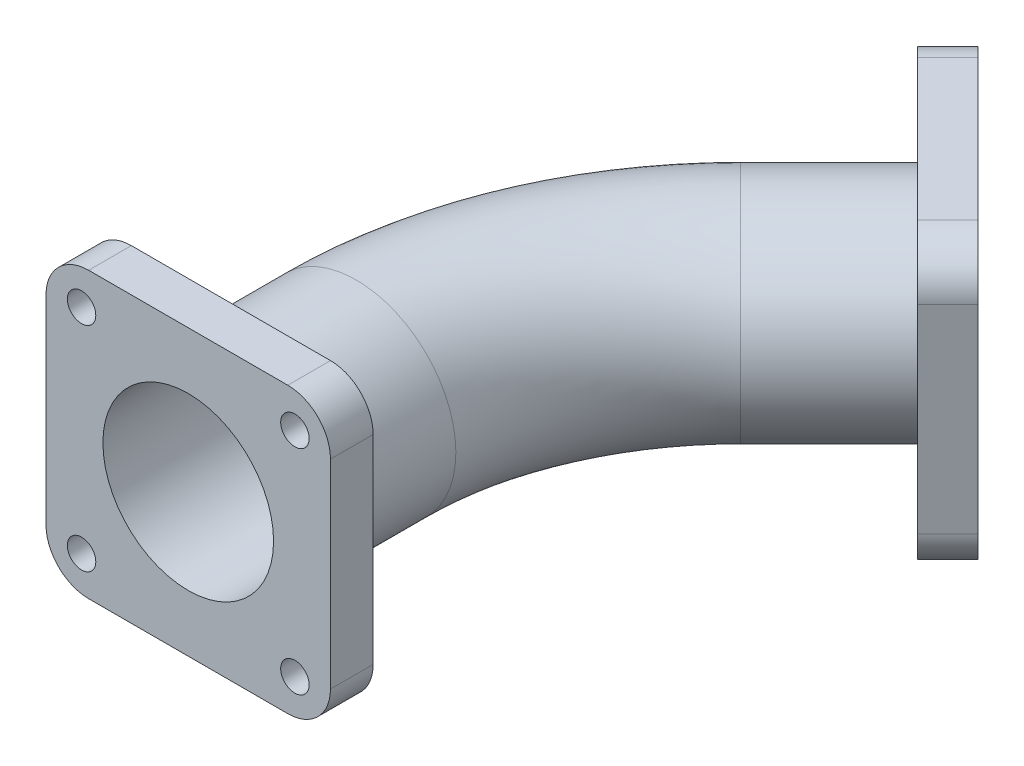
from build123d import *

# Parameters (mm, degrees)
CROQUIS1_W              = 100
CROQUIS1_H              = 100
SALIENTE_EXTRUIR1_DEPTH = 15
CROQUIS2_R              = 30
CROQUIS2_R_2            = 5
CORTAR_EXTRUIR1_DEPTH   = 15
CROQUIS9_R              = 35
CROQUIS9_R_2            = 30
CROQUIS12_W             = 100
CROQUIS12_H             = 100
SALIENTE_EXTRUIR2_DEPTH = 15
CORTAR_EXTRUIR2_START   = 15
CROQUIS13_R             = 30
CROQUIS13_R_2           = 5
CORTAR_EXTRUIR2_DEPTH   = 15
REDONDEO1_R             = 15


with BuildPart() as part:
    # Croquis1 → Saliente-Extruir1 (new body)
    with BuildSketch(Plane.XY):
        Rectangle(CROQUIS1_W, CROQUIS1_H)
    extrude(amount=SALIENTE_EXTRUIR1_DEPTH)

    # Croquis2 → Cortar-Extruir1 (cut)
    with BuildSketch(Plane.XY):
        Circle(CROQUIS2_R)
        with Locations((-37.5, 37.5)):
            Circle(CROQUIS2_R_2)
        with Locations((37.5, 37.5)):
            Circle(CROQUIS2_R_2)
        with Locations((37.5, -37.5)):
            Circle(CROQUIS2_R_2)
        with Locations((-37.5, -37.5)):
            Circle(CROQUIS2_R_2)
    extrude(amount=CORTAR_EXTRUIR1_DEPTH, mode=Mode.SUBTRACT)

    # Barrer1: sweep along a path in Croquis3
    with BuildLine(Plane(origin=(0, 0, 0), x_dir=(1, 0, 0), z_dir=(0, 1, 0))) as barrer1_path:
        Line((0, 0), (0, 44.08116908))
        ThreePointArc((0, 44.08116908), (10.276263111, 95.743432449), (39.54058454, 139.54058454))
        Line((39.54058454, 139.54058454), (70.710678119, 170.710678119))
    # Croquis9 → Barrer1 (sweep)
    with BuildSketch(Plane.XY):
        Circle(CROQUIS9_R)
        Circle(CROQUIS9_R_2, mode=Mode.SUBTRACT)
    sweep(path=barrer1_path.line)

    # Croquis12 → Saliente-Extruir2 (add)
    with BuildSketch(Plane(origin=(120.710678119, 0, -120.710678119), x_dir=(-0.7071067811865462, 0, -0.7071067811865489), z_dir=(0.7071067811865489, 0, -0.7071067811865462))):
        with Locations((70.710678119, 0)):
            Rectangle(CROQUIS12_W, CROQUIS12_H)
    extrude(amount=SALIENTE_EXTRUIR2_DEPTH)

    # Croquis13 → Cortar-Extruir2 (cut)
    with BuildSketch(Plane(origin=(120.710678119, 0, -120.710678119), x_dir=(-0.7071067811865462, 0, -0.7071067811865489), z_dir=(0.7071067811865489, 0, -0.7071067811865462)).offset(CORTAR_EXTRUIR2_START)):
        with Locations((70.710678119, 0)):
            Circle(CROQUIS13_R)
        with Locations((108.210678119, 37.5)):
            Circle(CROQUIS13_R_2)
        with Locations((108.210678119, -37.5)):
            Circle(CROQUIS13_R_2)
        with Locations((33.210678119, -37.5)):
            Circle(CROQUIS13_R_2)
        with Locations((33.210678119, 37.5)):
            Circle(CROQUIS13_R_2)
    extrude(amount=-CORTAR_EXTRUIR2_DEPTH, mode=Mode.SUBTRACT)

    # Redondeo1
    redondeo1_edges = [part.edges().sort_by_distance(p)[0] for p in [
        (40.658639918, -50, -211.369318037),
        (40.658639918, 50, -211.369318037),
        (111.369318037, 50, -140.658639918),
        (111.369318037, -50, -140.658639918),
        (50, -50, 7.5),
        (-50, -50, 7.5),
        (-50, 50, 7.5),
        (50, 50, 7.5),
    ]]
    fillet(redondeo1_edges, radius=REDONDEO1_R)


solid = part.part
